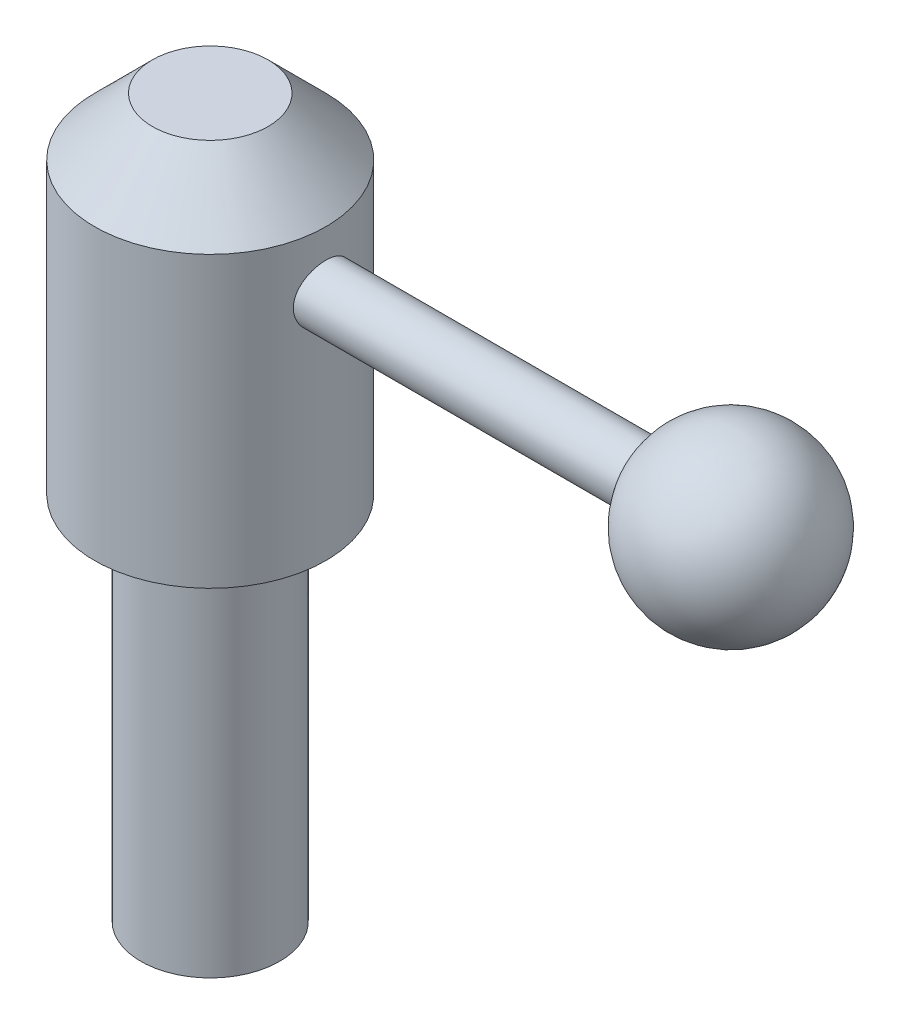
from build123d import *

# Parameters (mm, degrees)
CHAMFER1_SIZE = 5


with BuildPart() as part:
    # Sketch1 → Revolve1 (revolve)
    with BuildSketch(Plane.XY, mode=Mode.PRIVATE) as revolve1_sk:
        Polygon((0, 0), (0, 62), (-10, 62), (-10, 32), (-6, 32), (-6, 0), align=None)
    revolve(revolve1_sk.sketch.rotate(Axis((0, 0, 0), (0, 1, 0)), 270), axis=Axis((0, 0, 0), (0, 1, 0)))

    # Chamfer1
    chamfer1_edges = [part.edges().sort_by_distance(p)[0] for p in [
        (0, 62, 10),
    ]]
    chamfer(chamfer1_edges, length=CHAMFER1_SIZE)

    # Sketch2 → Revolve2 (revolve)
    with BuildSketch(Plane.XY, mode=Mode.PRIVATE) as revolve2_sk:
        with BuildLine():
            Line((0, 54.5), (0, 52))
            Line((0, 52), (52.5, 52))
            ThreePointArc((52.5, 52), (46.26826484, 59.391989197), (37.928932188, 54.5))
            Line((37.928932188, 54.5), (0, 54.5))
        make_face()
    revolve(revolve2_sk.sketch.rotate(Axis((0, 52, 0), (1, 0, 0)), 90), axis=Axis((0, 52, 0), (1, 0, 0)))


solid = part.part
